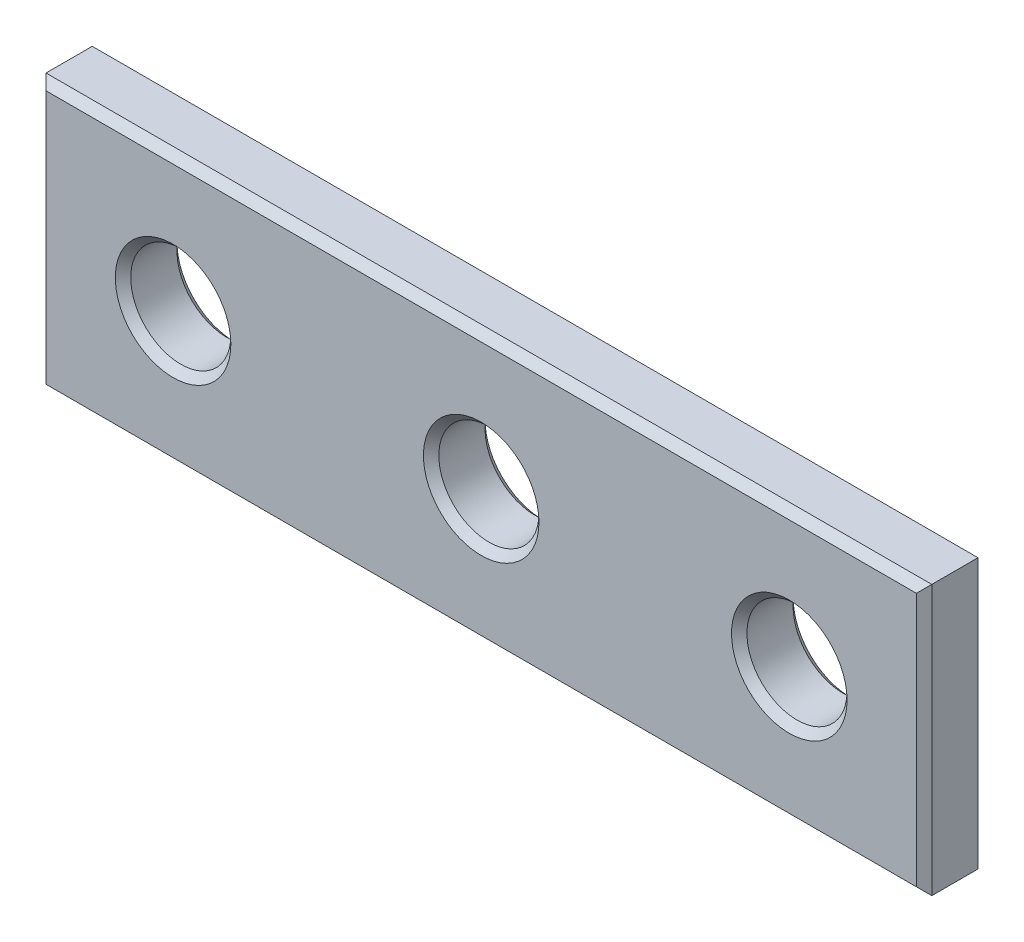
from build123d import *

# Parameters (mm, degrees)
SKETCH_1_W        = 230
SKETCH_1_H        = 70
SKETCH_1_R        = 13
EXTRUDE_322_DEPTH = 16
CHAMFER_1_SIZE    = 2


with BuildPart() as part:
    # 草图1 → Extrude 322 (new body)
    with BuildSketch(Plane.XY):
        Rectangle(SKETCH_1_W, SKETCH_1_H)
        Circle(SKETCH_1_R, mode=Mode.SUBTRACT)
        with Locations((80, 0)):
            Circle(SKETCH_1_R, mode=Mode.SUBTRACT)
        with Locations((-80, 0)):
            Circle(SKETCH_1_R, mode=Mode.SUBTRACT)
    extrude(amount=EXTRUDE_322_DEPTH)

    # 倒角1
    chamfer_1_edges = [part.edges().sort_by_distance(p)[0] for p in [
        (115, 0, 16),
        (-13, 0, 0),
        (-13, 0, 16),
        (0, 35, 16),
        (67, 0, 0),
        (67, 0, 16),
        (-93, 0, 0),
        (-93, 0, 16),
        (-115, 0, 16),
        (0, 35, 0),
        (115, 0, 0),
        (0, -35, 0),
        (-115, 0, 0),
        (0, -35, 16),
    ]]
    chamfer(chamfer_1_edges, length=CHAMFER_1_SIZE)


solid = part.part
